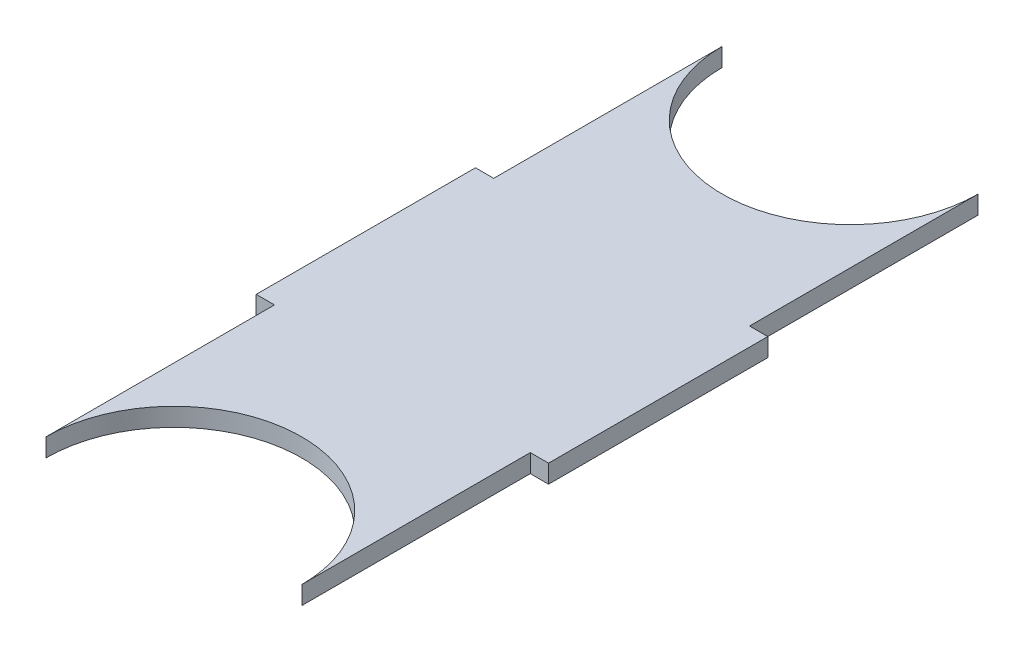
from build123d import *

# Parameters (mm, degrees)
SKETCH1_W           = 1.5875
SKETCH1_H           = 19.05
BOSS_EXTRUDE1_DEPTH = 1.5875


with BuildPart() as part:
    # Sketch1 → Boss-Extrude1 (new body)
    with BuildSketch(Plane(origin=(0, 0, 0), x_dir=(1, 0, 0), z_dir=(0, 1, 0))):
        with BuildLine():
            Line((11.1125, 27.788669701), (11.1125, -30.963669701))
            ThreePointArc((11.1125, -30.963669701), (0, -19.851169701), (-11.1125, -30.963669701))
            Line((-11.1125, -30.963669701), (-11.1125, 27.788669701))
            ThreePointArc((-11.1125, 27.788669701), (0, 16.676169701), (11.1125, 27.788669701))
        make_face()
        with Locations((11.90625, -1.5875)):
            Rectangle(SKETCH1_W, SKETCH1_H)
        with Locations((-11.90625, -1.5875)):
            Rectangle(SKETCH1_W, SKETCH1_H)
    extrude(amount=BOSS_EXTRUDE1_DEPTH)


solid = part.part
